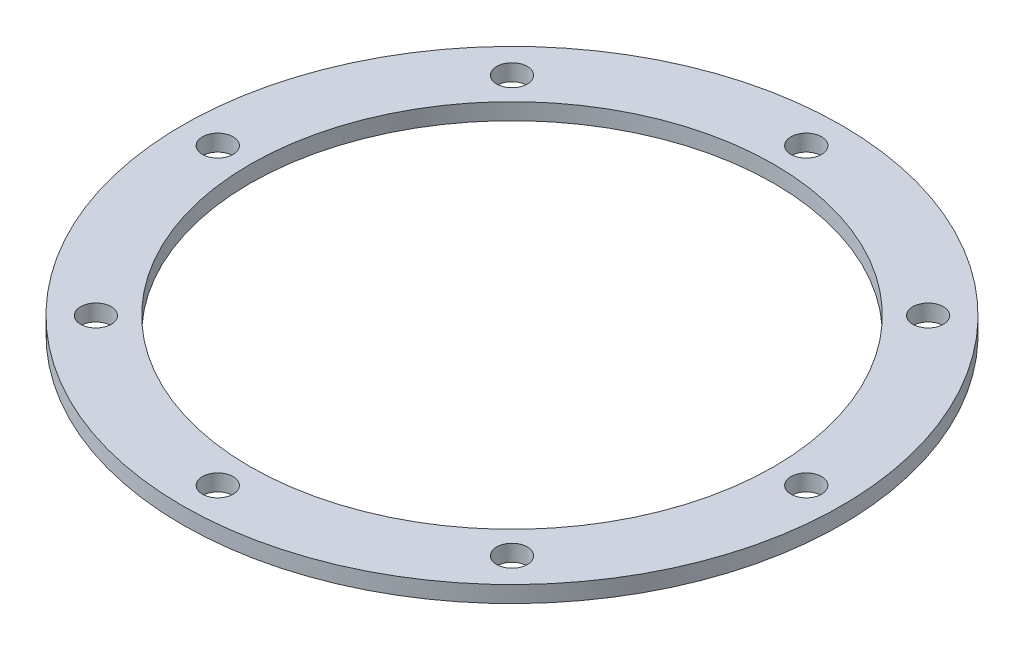
from build123d import *

# Parameters (mm, degrees)
SKETCH1_R           = 28
SKETCH1_R_2         = 22.25
BOSS_EXTRUDE1_DEPTH = 1.4
CIRPATTERN1_COUNT   = 8


with BuildPart() as part:
    # Sketch1 → Boss-Extrude1 (new body)
    with BuildSketch(Plane(origin=(0, 0, 0), x_dir=(1, 0, 0), z_dir=(0, 1, 0))):
        with Locations(Location((0, 0, 0), (0, 0, 270))):
            Circle(SKETCH1_R)
        with Locations(Location((0, 0, 0), (0, 0, 270))):
            Circle(SKETCH1_R_2, mode=Mode.SUBTRACT)
    extrude(amount=BOSS_EXTRUDE1_DEPTH)

    # Sketch4 → M2 Clearance Hole1 (revolve, cut)
    with BuildSketch(Plane(origin=(0, 1.4, -25), x_dir=(0, 0, 1), z_dir=(1, 0, 0))):
        Polygon((0, 0), (0, 17.799118805), (1.3, 17.018), (1.3, 0), align=None)
    m2_clearance_hole1 = revolve(axis=Axis((0, 7.75, -25), (0, -1, 0)), mode=Mode.SUBTRACT)

    # CirPattern1: M2 Clearance Hole1 ×8 about axis
    cirpattern1_axis = Axis((0, 0, 0), (0, 1, 0))
    for i in range(1, CIRPATTERN1_COUNT):
        add(m2_clearance_hole1.rotate(cirpattern1_axis, i * 360 / CIRPATTERN1_COUNT), mode=Mode.SUBTRACT)


solid = part.part
